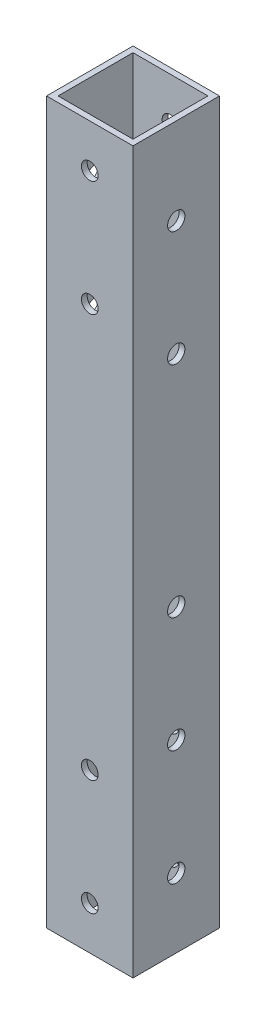
from build123d import *

# Parameters (mm, degrees)
SKETCH_1_W          = 15
SKETCH_1_H          = 15
SKETCH_1_W_2        = 13
SKETCH_1_H_2        = 13
EXTRUDE_1_DEPTH     = 125
SKETCH_2_R          = 1.45
CUT_EXTRUDE_1_DEPTH = 127.119982556
SKETCH_3_R          = 1.5
CUT_EXTRUDE_2_DEPTH = 127.119982556


with BuildPart() as part:
    # 草图1 → 拉伸-薄壁1 (new body)
    with BuildSketch(Plane(origin=(0, 0, 0), x_dir=(1, 0, 0), z_dir=(0, 1, 0))):
        Rectangle(SKETCH_1_W, SKETCH_1_H)
        Rectangle(SKETCH_1_W_2, SKETCH_1_H_2, mode=Mode.SUBTRACT)
    extrude(amount=EXTRUDE_1_DEPTH)

    # 草图2 → 切除-拉伸1 (cut, through all)
    with BuildSketch(Plane.XY.offset(7.5)):
        with Locations((0, 7.5)):
            Circle(SKETCH_2_R)
        with Locations((0, 27.5)):
            Circle(SKETCH_2_R)
        with Locations(Location((0, 97.5, 0), (0, 0, 180))):
            Circle(SKETCH_2_R)
        with Locations(Location((0, 117.5, 0), (0, 0, 180))):
            Circle(SKETCH_2_R)
    extrude(amount=-CUT_EXTRUDE_1_DEPTH, mode=Mode.SUBTRACT)

    # 草图3 → 切除-拉伸2 (cut, through all)
    with BuildSketch(Plane(origin=(7.5, 0, 0), x_dir=(0, 0, -1), z_dir=(1, 0, 0))):
        with Locations((0, 32)):
            Circle(SKETCH_3_R)
        with Locations((0, 12)):
            Circle(SKETCH_3_R)
        with Locations((0, 52)):
            Circle(SKETCH_3_R)
        with Locations((0, 110)):
            Circle(SKETCH_3_R)
        with Locations((0, 90)):
            Circle(SKETCH_3_R)
    extrude(amount=-CUT_EXTRUDE_2_DEPTH, mode=Mode.SUBTRACT)


solid = part.part
